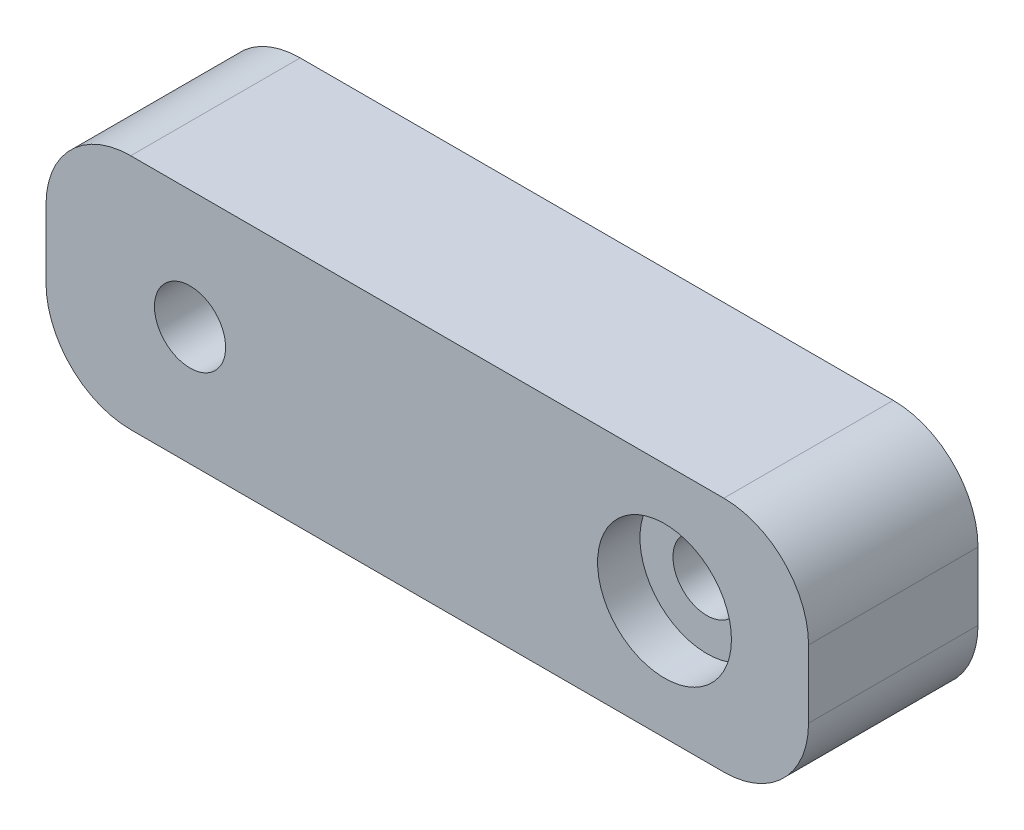
from build123d import *

# Parameters (mm, degrees)
SKETCH1_W           = 45
SKETCH1_H           = 14
BOSS_EXTRUDE1_DEPTH = 10
FILLET1_R           = 5
FILLET2_R           = 5
SKETCH2_R           = 4
CUT_EXTRUDE2_DEPTH  = 2.5
SKETCH3_R           = 2.1
CUT_EXTRUDE3_DEPTH  = 2
SKETCH4_R           = 3.95
CUT_EXTRUDE4_DEPTH  = 5
CUT_EXTRUDE5_REACH  = 64.926
SKETCH5_R           = 2
SKETCH7_R           = 2.1
CUT_EXTRUDE6_DEPTH  = 63.967570185
BOSS_EXTRUDE2_START = 2.5
SKETCH9_R           = 3.95
SKETCH9_R_2         = 2
BOSS_EXTRUDE2_DEPTH = 2.5
CUT_EXTRUDE7_START  = -3
SKETCH10_R          = 2
CUT_EXTRUDE7_DEPTH  = 3


with BuildPart() as part:
    # Sketch1 → Boss-Extrude1 (new body)
    with BuildSketch(Plane.XY):
        with Locations((-36.850618243, 13.301945946)):
            Rectangle(SKETCH1_W, SKETCH1_H)
    extrude(amount=BOSS_EXTRUDE1_DEPTH)

    # Fillet1
    fillet1_edges = [part.edges().sort_by_distance(p)[0] for p in [
        (-59.350618243, 20.301945946, 5),
    ]]
    fillet(fillet1_edges, radius=FILLET1_R)

    # Fillet2
    fillet2_edges = [part.edges().sort_by_distance(p)[0] for p in [
        (-14.350618243, 20.301945946, 5),
        (-14.350618243, 6.301945946, 5),
        (-59.350618243, 6.301945946, 5),
    ]]
    fillet(fillet2_edges, radius=FILLET2_R)

    # Sketch2 → Cut-Extrude2 (cut)
    with BuildSketch(Plane(origin=(0, 0, 0), x_dir=(-1, 0, 0), z_dir=(0, 0, -1))):
        with Locations((50.850618243, 13.301945946)):
            Circle(SKETCH2_R)
    extrude(amount=-CUT_EXTRUDE2_DEPTH, mode=Mode.SUBTRACT)

    # Sketch3 → Cut-Extrude3 (cut)
    with BuildSketch(Plane(origin=(0, 0, 2.5), x_dir=(-1, 0, 0), z_dir=(0, 0, -1))):
        with Locations((50.850618243, 13.301945946)):
            Circle(SKETCH3_R)
    extrude(amount=-CUT_EXTRUDE3_DEPTH, mode=Mode.SUBTRACT)

    # Sketch4 → Cut-Extrude4 (cut)
    with BuildSketch(Plane.XY.offset(10)):
        with Locations((-22.850618243, 13.301945946)):
            Circle(SKETCH4_R)
    extrude(amount=-CUT_EXTRUDE4_DEPTH, mode=Mode.SUBTRACT)

    # Sketch5 → Cut-Extrude5 (cut, up to next)
    with BuildSketch(Plane.XY.offset(5), mode=Mode.PRIVATE) as cut_extrude5_sk1:
        with Locations((-22.850618243, 13.301945946)):
            Circle(SKETCH5_R)
    cut_extrude5_tool1 = extrude(cut_extrude5_sk1.sketch, amount=-CUT_EXTRUDE5_REACH, mode=Mode.PRIVATE) & part.part
    add(cut_extrude5_tool1.solids().sort_by_distance((-22.850618, 13.301946, 5))[0], mode=Mode.SUBTRACT)

    # Sketch7 → Cut-Extrude6 (cut, through all)
    with BuildSketch(Plane(origin=(0, 0, 4.5), x_dir=(-1, 0, 0), z_dir=(0, 0, -1))):
        with Locations((50.850618243, 13.301945946)):
            Circle(SKETCH7_R)
    extrude(amount=-CUT_EXTRUDE6_DEPTH, mode=Mode.SUBTRACT)

    # Sketch9 → Boss-Extrude2 (add)
    with BuildSketch(Plane.XY.offset(5).offset(BOSS_EXTRUDE2_START)):
        with Locations((-22.850618243, 13.301945946)):
            Circle(SKETCH9_R)
        with Locations((-22.850618243, 13.301945946)):
            Circle(SKETCH9_R_2, mode=Mode.SUBTRACT)
    extrude(amount=-BOSS_EXTRUDE2_DEPTH)

    # Sketch10 → Cut-Extrude7 (cut)
    with BuildSketch(Plane(origin=(0, 0, 0), x_dir=(-1, 0, 0), z_dir=(0, 0, -1)).offset(CUT_EXTRUDE7_START)):
        Polygon((22.850618243, 17.34339783), (19.350618243, 15.322671888), (19.350618243, 11.281220004), (22.850618243, 9.260494062), (26.350618243, 11.281220004), (26.350618243, 15.322671888), align=None)
        with Locations(Location((22.850618243, 13.301945946, 0), (0, 0, 180))):
            Circle(SKETCH10_R, mode=Mode.SUBTRACT)
    extrude(amount=CUT_EXTRUDE7_DEPTH, mode=Mode.SUBTRACT)


solid = part.part
